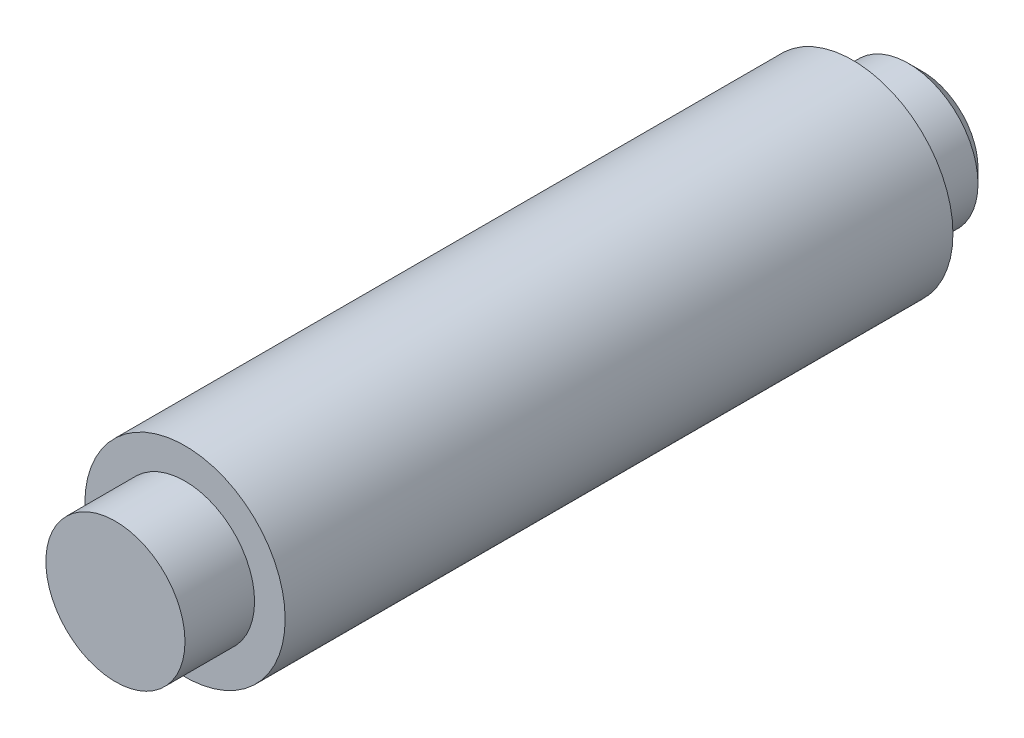
from build123d import *

# Parameters (mm, degrees)
SKETCH3_R           = 3.6
BOSS_EXTRUDE1_DEPTH = 24
SKETCH4_R           = 2.5
BOSS_EXTRUDE2_DEPTH = 2.5
BOSS_EXTRUDE3_START = 2.5
SKETCH5_R           = 2.5
BOSS_EXTRUDE3_DEPTH = 2.5
CHAMFER1_SIZE       = 0.5


with BuildPart() as part:
    # Sketch3 → Boss-Extrude1 (new body)
    with BuildSketch(Plane.XY):
        Circle(SKETCH3_R)
    extrude(amount=BOSS_EXTRUDE1_DEPTH)

    # Sketch4 → Boss-Extrude2 (add)
    with BuildSketch(Plane.XY):
        Circle(SKETCH4_R)
    extrude(amount=-BOSS_EXTRUDE2_DEPTH)

    # Sketch5 → Boss-Extrude3 (add)
    with BuildSketch(Plane.XY.offset(24).offset(BOSS_EXTRUDE3_START)):
        Circle(SKETCH5_R)
    extrude(amount=-BOSS_EXTRUDE3_DEPTH)

    # Chamfer1
    chamfer1_edges = [part.edges().sort_by_distance(p)[0] for p in [
        (-2.5, 0, -2.5),
    ]]
    chamfer(chamfer1_edges, length=CHAMFER1_SIZE)


solid = part.part
